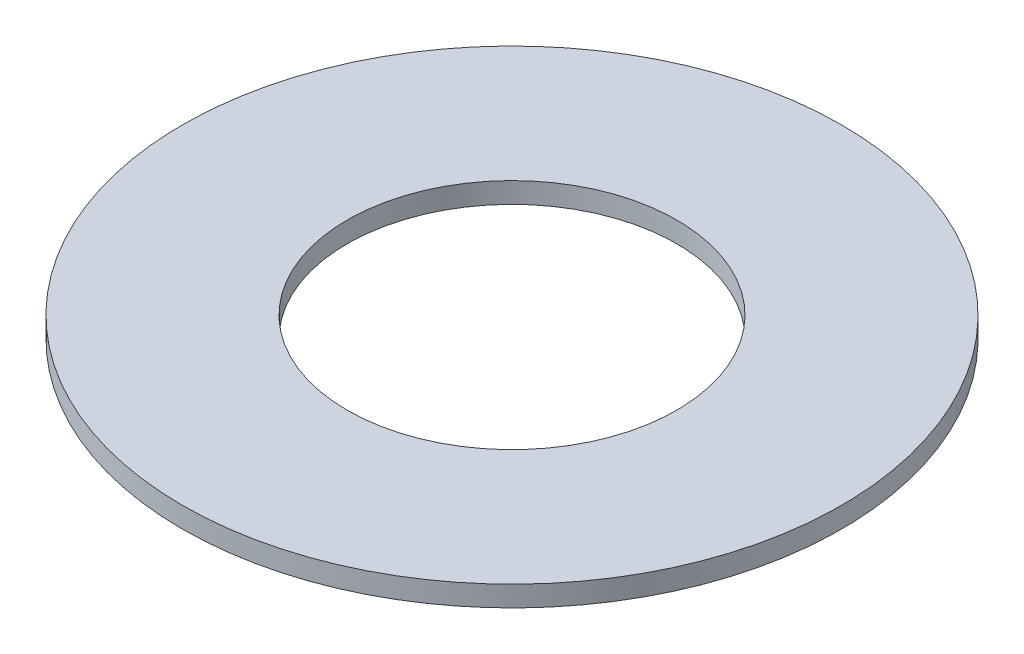
from build123d import *

# Parameters (mm, degrees)
SKETCH1_R           = 12.7
SKETCH1_R_2         = 6.35
BOSS_EXTRUDE1_DEPTH = 0.79375


with BuildPart() as part:
    # Sketch1 → Boss-Extrude1 (new body)
    with BuildSketch(Plane(origin=(0, 0, 0), x_dir=(1, 0, 0), z_dir=(0, 1, 0))):
        with Locations(Location((0, 0, 0), (0, 0, 270))):
            Circle(SKETCH1_R)
        with Locations(Location((0, 0, 0), (0, 0, 270))):
            Circle(SKETCH1_R_2, mode=Mode.SUBTRACT)
    extrude(amount=BOSS_EXTRUDE1_DEPTH)


solid = part.part
